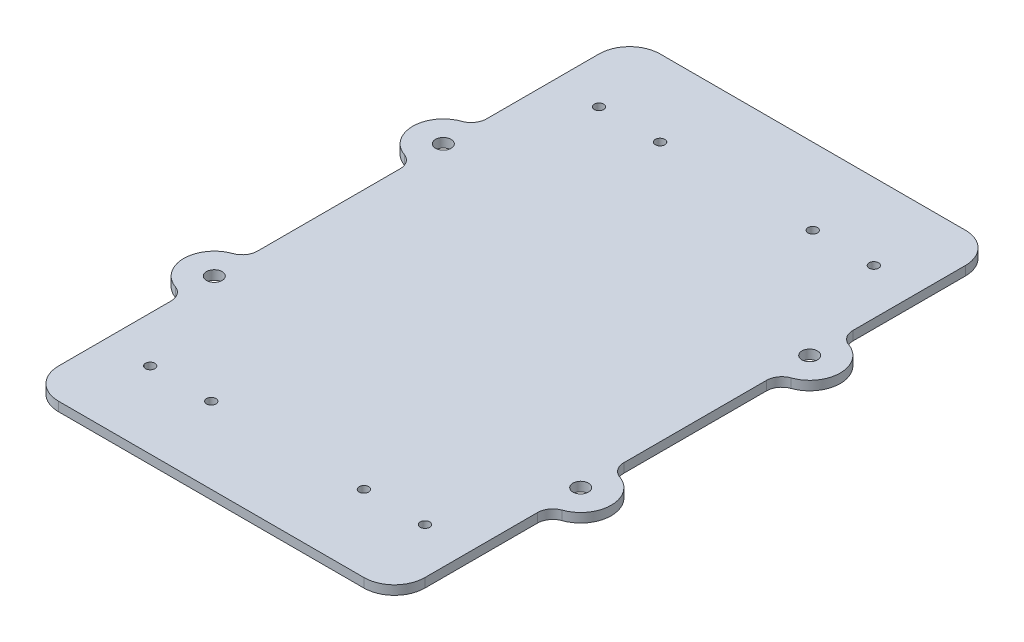
from build123d import *

# Parameters (mm, degrees)
SKETCH1_R           = 2.55
BOSS_EXTRUDE1_DEPTH = 3
SKETCH2_R           = 1.55
GIMBALHOLES_DEPTH   = 3
FILLET1_R           = 10
FILLET2_R           = 5


with BuildPart() as part:
    # Sketch1 → Boss-Extrude1 (new body)
    with BuildSketch(Plane(origin=(0, 0, 0), x_dir=(1, 0, 0), z_dir=(0, 1, 0))):
        with BuildLine():
            Line((-60, 27.5), (-60, -27.5))
            ThreePointArc((-60, -27.5), (-70, -37.5), (-60, -47.5))
            Line((-60, -47.5), (-60, -98.5))
            Line((-60, -98.5), (60.000001096, -98.5))
            Line((60.000001096, -98.5), (60.000001096, -47.5))
            ThreePointArc((60.000001096, -47.5), (70, -37.499999452), (60, -27.5))
            Line((60, -27.5), (60, 27.5))
            ThreePointArc((60, 27.5), (70, 37.499999452), (60.000001096, 47.5))
            Line((60.000001096, 47.5), (60.000001096, 98.5))
            Line((60.000001096, 98.5), (-60, 98.5))
            Line((-60, 98.5), (-60, 47.5))
            ThreePointArc((-60, 47.5), (-70, 37.5), (-60, 27.5))
        make_face()
        with Locations(Location((-60, 37.5, 0), (0, 0, 270))):
            Circle(SKETCH1_R, mode=Mode.SUBTRACT)
        with Locations(Location((60, 37.5, 0), (0, 0, 270))):
            Circle(SKETCH1_R, mode=Mode.SUBTRACT)
        with Locations(Location((-60, -37.5, 0), (0, 0, 270))):
            Circle(SKETCH1_R, mode=Mode.SUBTRACT)
        with Locations(Location((60, -37.5, 0), (0, 0, 270))):
            Circle(SKETCH1_R, mode=Mode.SUBTRACT)
    extrude(amount=BOSS_EXTRUDE1_DEPTH)

    # Sketch2 → GimbalHoles (cut)
    with BuildSketch(Plane(origin=(0, 3, 0), x_dir=(1, 0, 0), z_dir=(0, 1, 0))):
        with Locations(Location((-44.999998904, 73.5, 0), (0, 0, 270))):
            Circle(SKETCH2_R)
        with Locations(Location((-24.999998904, 73.5, 0), (0, 0, 270))):
            Circle(SKETCH2_R)
        with Locations(Location((25.000001096, 73.5, 0), (0, 0, 270))):
            Circle(SKETCH2_R)
        with Locations(Location((45.000001096, 73.5, 0), (0, 0, 270))):
            Circle(SKETCH2_R)
        with Locations(Location((-44.999998904, -73.5, 0), (0, 0, 270))):
            Circle(SKETCH2_R)
        with Locations(Location((-24.999998904, -73.5, 0), (0, 0, 270))):
            Circle(SKETCH2_R)
        with Locations(Location((25.000001096, -73.5, 0), (0, 0, 270))):
            Circle(SKETCH2_R)
        with Locations(Location((45.000001096, -73.5, 0), (0, 0, 270))):
            Circle(SKETCH2_R)
    extrude(amount=-GIMBALHOLES_DEPTH, mode=Mode.SUBTRACT)

    # Fillet1
    fillet1_edges = [part.edges().sort_by_distance(p)[0] for p in [
        (-60, 1.5, -98.5),
        (60.000001096, 1.5, -98.5),
        (60.000001096, 1.5, 98.5),
        (-60, 1.5, 98.5),
    ]]
    fillet(fillet1_edges, radius=FILLET1_R)

    # Fillet2
    fillet2_edges = [part.edges().sort_by_distance(p)[0] for p in [
        (-60, 1.5, -47.5),
        (60.000001096, 1.5, -47.5),
        (60, 1.5, -27.5),
        (60, 1.5, 27.5),
        (60.000001096, 1.5, 47.5),
        (-60, 1.5, 47.5),
        (-60, 1.5, 27.5),
        (-60, 1.5, -27.5),
    ]]
    fillet(fillet2_edges, radius=FILLET2_R)


solid = part.part
